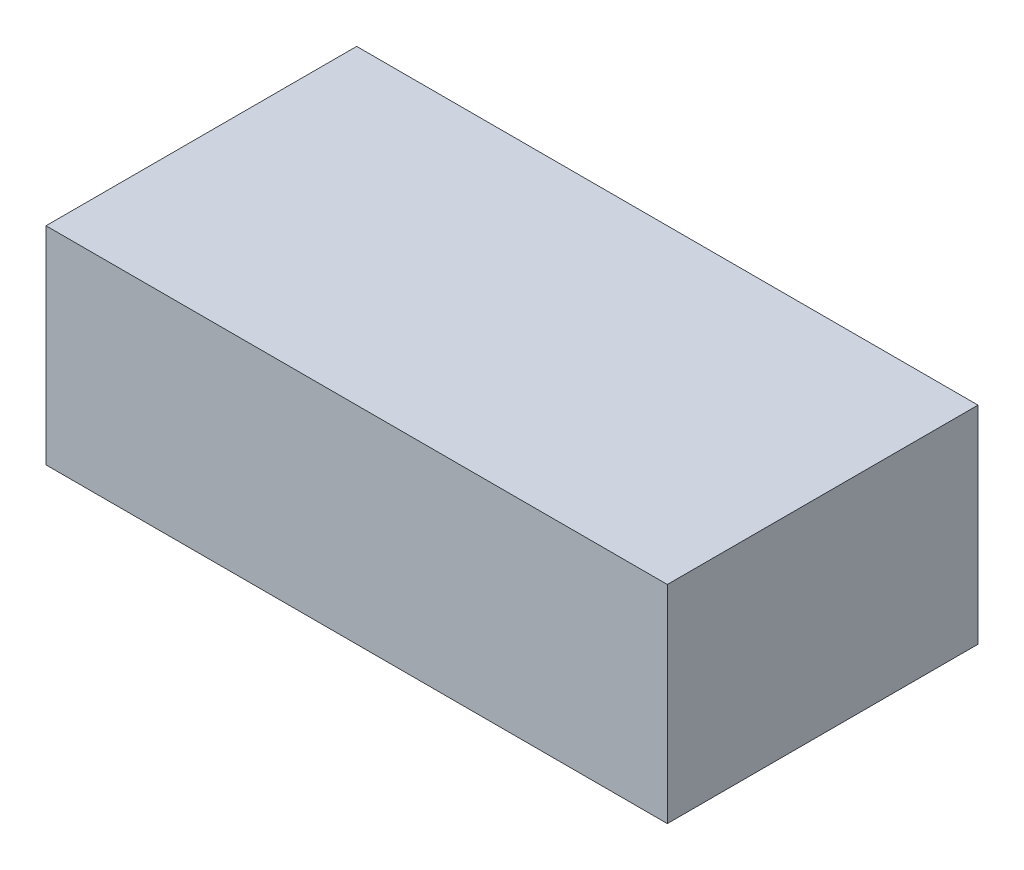
from build123d import *

# Parameters (mm, degrees)
SKETCH1_W           = 19.05
SKETCH1_H           = 9.525
BOSS_EXTRUDE1_DEPTH = 6.35


with BuildPart() as part:
    # Sketch1 → Boss-Extrude1 (new body)
    with BuildSketch(Plane(origin=(0, 0, 0), x_dir=(1, 0, 0), z_dir=(0, 1, 0))):
        Rectangle(SKETCH1_W, SKETCH1_H)
    extrude(amount=BOSS_EXTRUDE1_DEPTH)


solid = part.part
